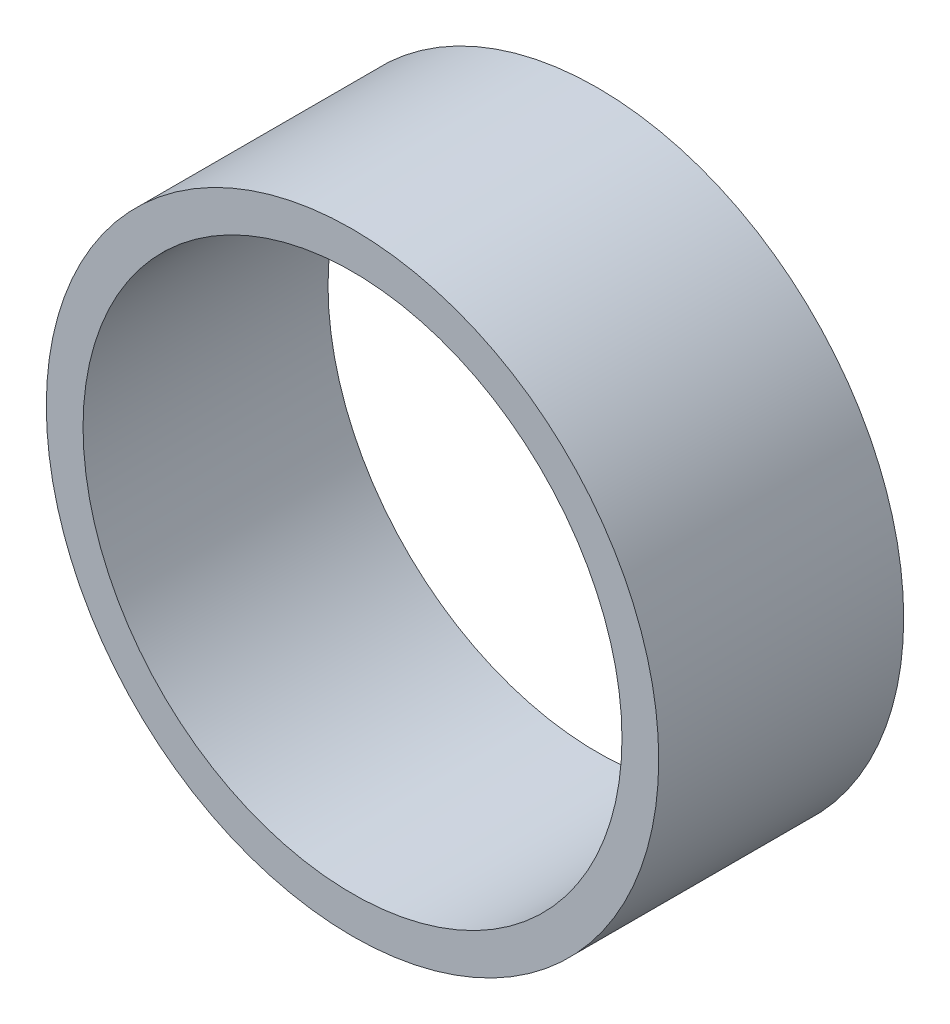
from build123d import *

# Parameters (mm, degrees)
ESQUISSE1_R             = 25
BOSS_EXTRU_1_DEPTH      = 20
ESQUISSE2_R             = 22
ENL_V_MAT_EXTRU_1_DEPTH = 41.620192023


with BuildPart() as part:
    # Esquisse1 → Boss.-Extru.1 (new body)
    with BuildSketch(Plane.XY):
        Circle(ESQUISSE1_R)
    extrude(amount=BOSS_EXTRU_1_DEPTH)

    # Esquisse2 → Enlèv. mat.-Extru.1 (cut, through all)
    with BuildSketch(Plane.XY.offset(20)):
        Circle(ESQUISSE2_R)
    extrude(amount=-ENL_V_MAT_EXTRU_1_DEPTH, mode=Mode.SUBTRACT)


solid = part.part
